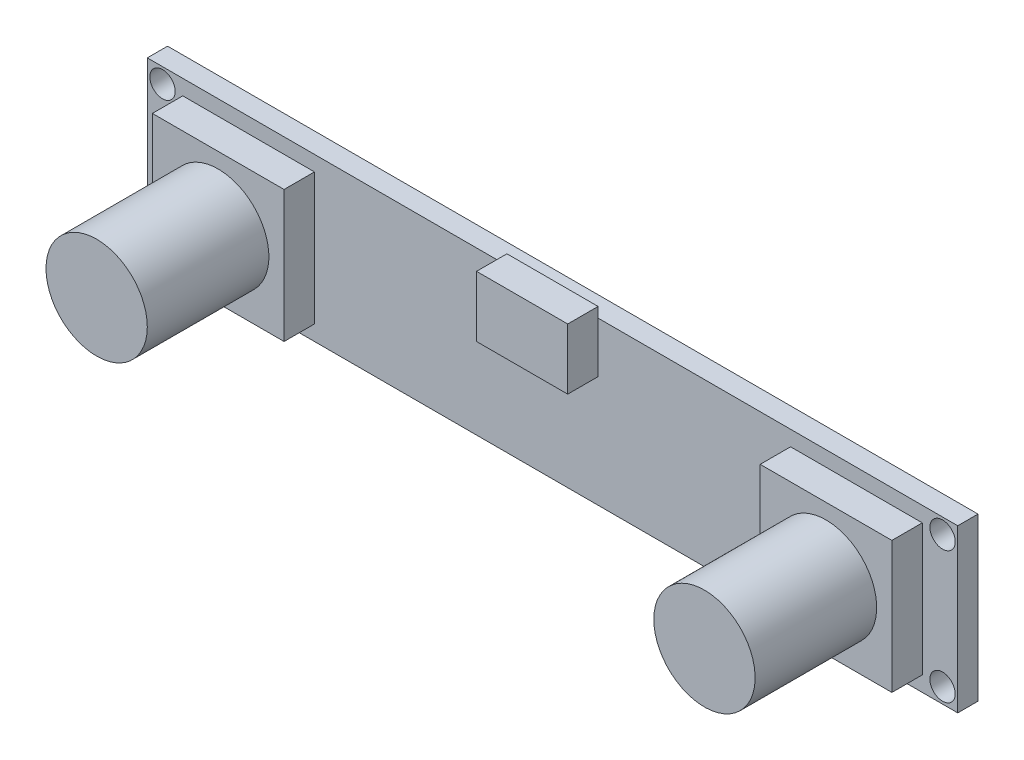
from build123d import *

# Parameters (mm, degrees)
SKETCH_1_W            = 80
SKETCH_1_H            = 16
EXTRUDE_404_DEPTH     = 2
SKETCH_5_R            = 1.25
CUT_EXTRUDE_623_DEPTH = 41.841155713
SKETCH_3_W            = 13
SKETCH_3_H            = 13
EXTRUDE_867_DEPTH     = 3
SKETCH_4_R            = 5
EXTRUDE_1060_DEPTH    = 12
SKETCH_2_W            = 9
SKETCH_2_H            = 6
MICROUSB_DEPTH        = 3


with BuildPart() as part:
    # Эскиз1 → Extrude 404 (new body)
    with BuildSketch(Plane.XY):
        Rectangle(SKETCH_1_W, SKETCH_1_H)
    extrude(amount=EXTRUDE_404_DEPTH)

    # Эскиз5 → Cut-Extrude 623 (cut, through all)
    with BuildSketch(Plane.XY.offset(2)):
        with Locations((-38.5, 6.5)):
            Circle(SKETCH_5_R)
        with Locations((38.5, 6.5)):
            Circle(SKETCH_5_R)
        with Locations((38.5, -6.5)):
            Circle(SKETCH_5_R)
        with Locations((-38.5, -6.5)):
            Circle(SKETCH_5_R)
    extrude(amount=-CUT_EXTRUDE_623_DEPTH, mode=Mode.SUBTRACT)

    # Эскиз3 → Extrude 867 (add)
    with BuildSketch(Plane.XY.offset(2)):
        with Locations((-30, 0)):
            Rectangle(SKETCH_3_W, SKETCH_3_H)
    extrude_867 = extrude(amount=EXTRUDE_867_DEPTH)

    # Эскиз4 → Extrude 1060 (add)
    with BuildSketch(Plane.XY.offset(5)):
        with Locations(Location((-30, 0, 0), (0, 0, 180))):
            Circle(SKETCH_4_R)
    extrude_1060 = extrude(amount=EXTRUDE_1060_DEPTH)

    # Зеркальное отражение1: Extrude 867, Extrude 1060 across plane
    add(extrude_867.mirror(Plane(origin=(0, 0, 0), x_dir=(0, 0, 1), z_dir=(1, 0, 0))))
    add(extrude_1060.mirror(Plane(origin=(0, 0, 0), x_dir=(0, 0, 1), z_dir=(1, 0, 0))))

    # Эскиз2 → microusb (add)
    with BuildSketch(Plane.XY.offset(2)):
        with Locations((0, 6)):
            Rectangle(SKETCH_2_W, SKETCH_2_H)
    extrude(amount=MICROUSB_DEPTH)


solid = part.part
